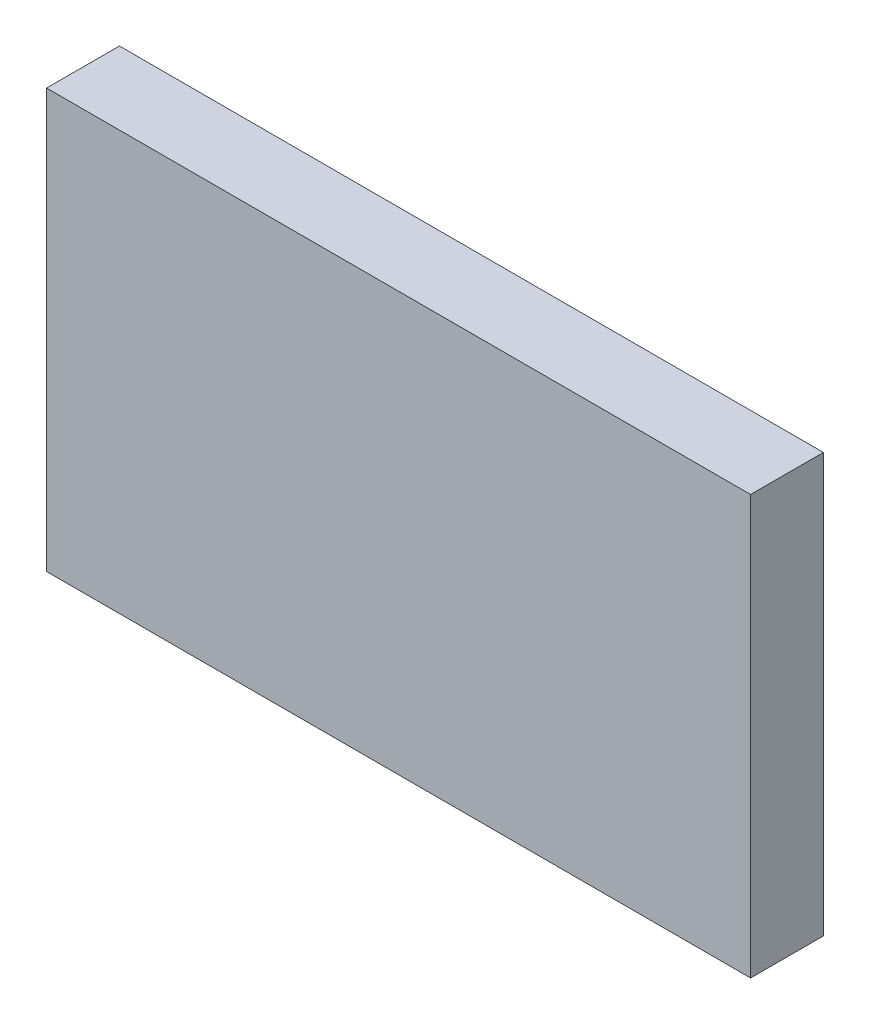
from build123d import *

# Parameters (mm, degrees)
SKETCH1_W           = 58
SKETCH1_H           = 34.5
BOSS_EXTRUDE1_DEPTH = 6


with BuildPart() as part:
    # Sketch1 → Boss-Extrude1 (new body)
    with BuildSketch(Plane.XY):
        Rectangle(SKETCH1_W, SKETCH1_H)
    extrude(amount=BOSS_EXTRUDE1_DEPTH)


solid = part.part
